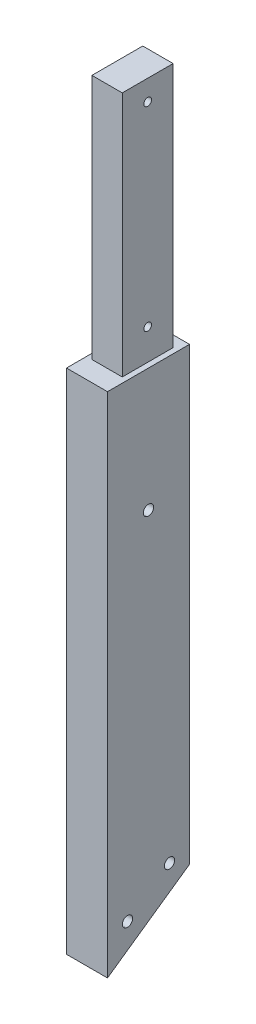
from build123d import *

# Parameters (mm, degrees)
SKETCH1_W               = 50.8
SKETCH1_H               = 314.489898324
BOSS_EXTRUDE1_DEPTH     = 25.4
CUT_EXTRUDE1_DEPTH      = 162.295672716
SKETCH3_R               = 3.175
CUT_EXTRUDE2_DEPTH      = 162.295672716
SKETCH6_W               = 25.4
SKETCH6_H               = 50.8
BOSS_EXTRUDE3_DEPTH     = 152.4
CUT_EXTRUDE4_DEPTH      = 312.721533651
CUT_EXTRUDE5_DEPTH      = 315.810728123
SKETCH5_R               = 2.38125
CUT_EXTRUDE3_DEPTH      = 312.543594923
CUT_EXTRUDE6_DEPTH      = 469.269684217
CUT_EXTRUDE6_DEPTH_BACK = 152.4
SKETCH9_R               = 29.953527753
SKETCH9_W               = 20.828
SKETCH9_H               = 33.528


with BuildPart() as part:
    # Sketch1 → Boss-Extrude1 (new body)
    with BuildSketch(Plane(origin=(0, 0, 0), x_dir=(0, 0, -1), z_dir=(1, 0, 0))):
        Rectangle(SKETCH1_W, SKETCH1_H)
    extrude(amount=BOSS_EXTRUDE1_DEPTH)

    # Sketch2 → Cut-Extrude1 (cut, through all)
    with BuildSketch(Plane(origin=(25.4, 0, 0), x_dir=(0, 0, -1), z_dir=(1, 0, 0))):
        Polygon((-25.4, -157.244949162), (25.4, -121.674406221), (50.8, -121.674406221), (50.8, -172.474406221), (-25.4, -172.474406221), align=None)
    extrude(amount=-CUT_EXTRUDE1_DEPTH, mode=Mode.SUBTRACT)

    # Sketch3 → Cut-Extrude2 (cut, through all)
    with BuildSketch(Plane(origin=(25.4, 0, 0), x_dir=(0, 0, -1), z_dir=(1, 0, 0))):
        with Locations((-13.004038703, -133.061366341)):
            Circle(SKETCH3_R)
        with Locations((13.004038703, -114.850314487)):
            Circle(SKETCH3_R)
        with Locations((0, 81.044949162)):
            Circle(SKETCH3_R)
    extrude(amount=-CUT_EXTRUDE2_DEPTH, mode=Mode.SUBTRACT)

    # Sketch6 → Boss-Extrude3 (add)
    with BuildSketch(Plane(origin=(0, 157.244949162, 0), x_dir=(1, 0, 0), z_dir=(0, 1, 0))):
        with Locations((12.7, 0)):
            Rectangle(SKETCH6_W, SKETCH6_H)
    extrude(amount=BOSS_EXTRUDE3_DEPTH)

    # Sketch7 → Cut-Extrude4 (cut, through all)
    with BuildSketch(Plane(origin=(25.4, 0, 0), x_dir=(0, 0, -1), z_dir=(1, 0, 0))):
        with BuildLine():
            Line((-25.4, 157.244949162), (-25.4, 309.644949162))
            Line((-25.4, 309.644949162), (-13.97, 309.644949162))
            Line((-13.97, 309.644949162), (-13.97, 163.594949162))
            ThreePointArc((-13.97, 163.594949162), (-15.829871939, 159.104821101), (-20.32, 157.244949162))
            Line((-20.32, 157.244949162), (-25.4, 157.244949162))
        make_face()
        with BuildLine():
            Line((39.293979998, 157.244949162), (25.908, 157.244949162))
            ThreePointArc((25.908, 157.244949162), (21.417871939, 159.104821101), (19.558, 163.594949162))
            Line((19.558, 163.594949162), (19.558, 309.644949162))
            Line((19.558, 309.644949162), (39.293979998, 309.644949162))
            Line((39.293979998, 309.644949162), (39.293979998, 157.244949162))
        make_face()
    extrude(amount=-CUT_EXTRUDE4_DEPTH, mode=Mode.SUBTRACT)

    # Sketch8 → Cut-Extrude5 (cut, through all)
    with BuildSketch(Plane.XY.offset(25.4)):
        with BuildLine():
            Line((2.286, 309.644949162), (-14.90160116, 309.644949162))
            Line((-14.90160116, 309.644949162), (-14.90160116, 157.244949162))
            Line((-14.90160116, 157.244949162), (-4.064, 157.244949162))
            ThreePointArc((-4.064, 157.244949162), (0.426128061, 159.104821101), (2.286, 163.594949162))
            Line((2.286, 163.594949162), (2.286, 309.644949162))
        make_face()
        with BuildLine():
            Line((23.114, 163.594949162), (23.114, 309.644949162))
            Line((23.114, 309.644949162), (40.983283112, 309.644949162))
            Line((40.983283112, 309.644949162), (40.983283112, 157.244949162))
            Line((40.983283112, 157.244949162), (29.464, 157.244949162))
            ThreePointArc((29.464, 157.244949162), (24.973871939, 159.104821101), (23.114, 163.594949162))
        make_face()
    extrude(amount=-CUT_EXTRUDE5_DEPTH, mode=Mode.SUBTRACT)

    # Sketch5 → Cut-Extrude3 (cut, through all)
    with BuildSketch(Plane(origin=(23.114, 0, 0), x_dir=(0, 0, -1), z_dir=(1, 0, 0))):
        with Locations(Location((2.794, 296.956244864, 0), (0, 0, 90))):
            Circle(SKETCH5_R)
        with Locations(Location((2.794, 176.306244864, 0), (0, 0, 90))):
            Circle(SKETCH5_R)
    extrude(amount=-CUT_EXTRUDE3_DEPTH, mode=Mode.SUBTRACT)

    # Sketch9 → Cut-Extrude6 (cut, two sides: drawn at the far end of the back side and taken through both)
    # profile 1 of 3: a face of its own
    with BuildSketch(Plane(origin=(0, 309.644949162, 0), x_dir=(1, 0, 0), z_dir=(0, 1, 0)).offset(-CUT_EXTRUDE6_DEPTH_BACK)):
        with Locations((12.7, 2.794)):
            Circle(SKETCH9_R)
        with Locations((12.7, 2.794)):
            Rectangle(SKETCH9_W, SKETCH9_H, mode=Mode.SUBTRACT)
    # profile 2 of 3: a face of its own
    with BuildSketch(Plane(origin=(0, 309.644949162, 0), x_dir=(1, 0, 0), z_dir=(0, 1, 0)).offset(-CUT_EXTRUDE6_DEPTH_BACK)):
        Polygon((3.302, 18.542), (12.7, 18.542), (12.7, 19.558), (2.286, 19.558), (2.286, -13.97), (12.7, -13.97), (12.7, -12.954), (3.302, -12.954), align=None)
    # profile 3 of 3: a face of its own
    with BuildSketch(Plane(origin=(0, 309.644949162, 0), x_dir=(1, 0, 0), z_dir=(0, 1, 0)).offset(-CUT_EXTRUDE6_DEPTH_BACK)):
        Polygon((12.7, 18.542), (22.098, 18.542), (22.098, 2.794), (22.098, -12.954), (12.7, -12.954), (12.7, -13.97), (23.114, -13.97), (23.114, 19.558), (12.7, 19.558), align=None)
    extrude(amount=CUT_EXTRUDE6_DEPTH + CUT_EXTRUDE6_DEPTH_BACK, mode=Mode.SUBTRACT)


solid = part.part
